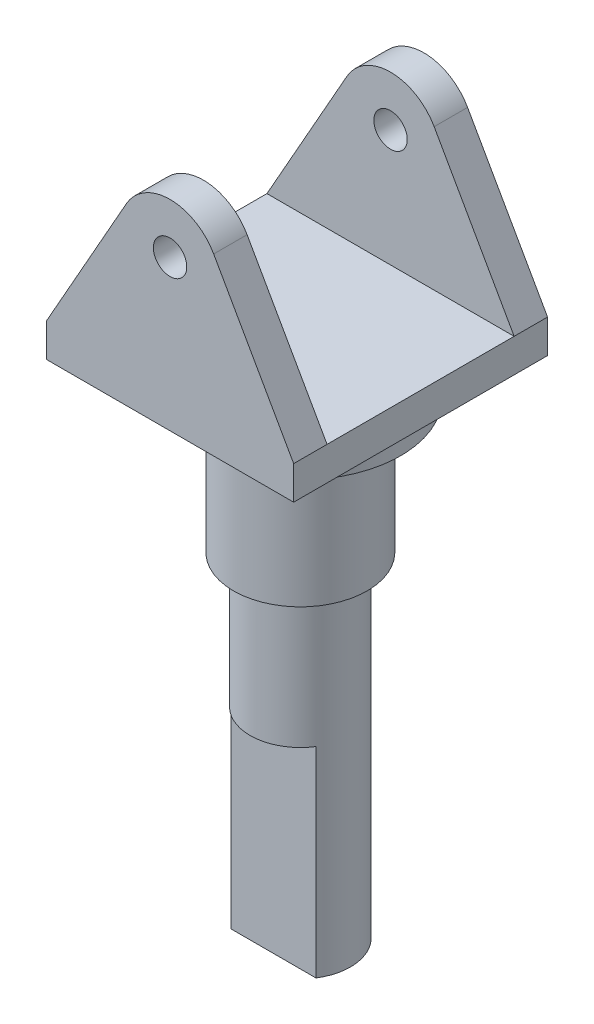
from build123d import *

# Parameters (mm, degrees)
SKETCH1_R           = 5
BOSS_EXTRUDE1_DEPTH = 76
SKETCH2_W           = 56
SKETCH2_H           = 51.048659901
CUT_EXTRUDE1_DEPTH  = 128
CUT_EXTRUDE2_START  = -10
CUT_EXTRUDE2_DEPTH  = 10
CUT_EXTRUDE3_DEPTH  = 60


with BuildPart() as part:
    # Sketch1 → Boss-Extrude1 (new body)
    with BuildSketch(Plane.XY):
        with BuildLine():
            Line((0, 0), (0, 10))
            Line((0, 10), (23.939862606, 52.377859531))
            ThreePointArc((23.939862606, 52.377859531), (36.99996154, 60), (50.06009956, 52.377926503))
            Line((50.06009956, 52.377926503), (74.000286667, 10))
            Line((74.000286667, 10), (74.000286667, 0))
            Line((74.000286667, 0), (0, 0))
        make_face()
        with Locations((37, 45)):
            Circle(SKETCH1_R, mode=Mode.SUBTRACT)
    extrude(amount=-BOSS_EXTRUDE1_DEPTH)

    # Sketch2 → Cut-Extrude1 (cut)
    with BuildSketch(Plane(origin=(0, 0, 0), x_dir=(0, 0, -1), z_dir=(1, 0, 0))):
        with Locations((38, 35.524329951)):
            Rectangle(SKETCH2_W, SKETCH2_H)
    extrude(amount=CUT_EXTRUDE1_DEPTH, mode=Mode.SUBTRACT)

    # Sketch6 → Revolve2 (revolve)
    with BuildSketch(Plane.ZY.offset(-38)):
        Polygon((-18, -10), (-8, -10), (-8, 0), (-38, 0), (-38, -150), (-23, -150), (-23, -50), (-18, -50), align=None)
    revolve(axis=Axis((38, 0, -38), (0, -1, 0)))

    # Sketch8 → Cut-Extrude2 (cut)
    with BuildSketch(Plane.XZ.offset(10).offset(CUT_EXTRUDE2_START)):
        with BuildLine():
            Line((56, -62), (20, -62))
            ThreePointArc((20, -62), (38, -68), (56, -62))
        make_face()
        with BuildLine():
            ThreePointArc((56, -14), (38, -8), (20, -14))
            Line((20, -14), (56, -14))
        make_face()
    extrude(amount=CUT_EXTRUDE2_DEPTH, mode=Mode.SUBTRACT)

    # Sketch9 → Cut-Extrude3 (cut)
    with BuildSketch(Plane.XZ.offset(150)):
        Polygon((-121.587546026, -30), (25.31142246, -30), (50.68857754, -30), (197.587546026, -30), (197.587546026, 263.79793697), (-121.587546026, 263.79793697), align=None)
    extrude(amount=-CUT_EXTRUDE3_DEPTH, mode=Mode.SUBTRACT)


solid = part.part
